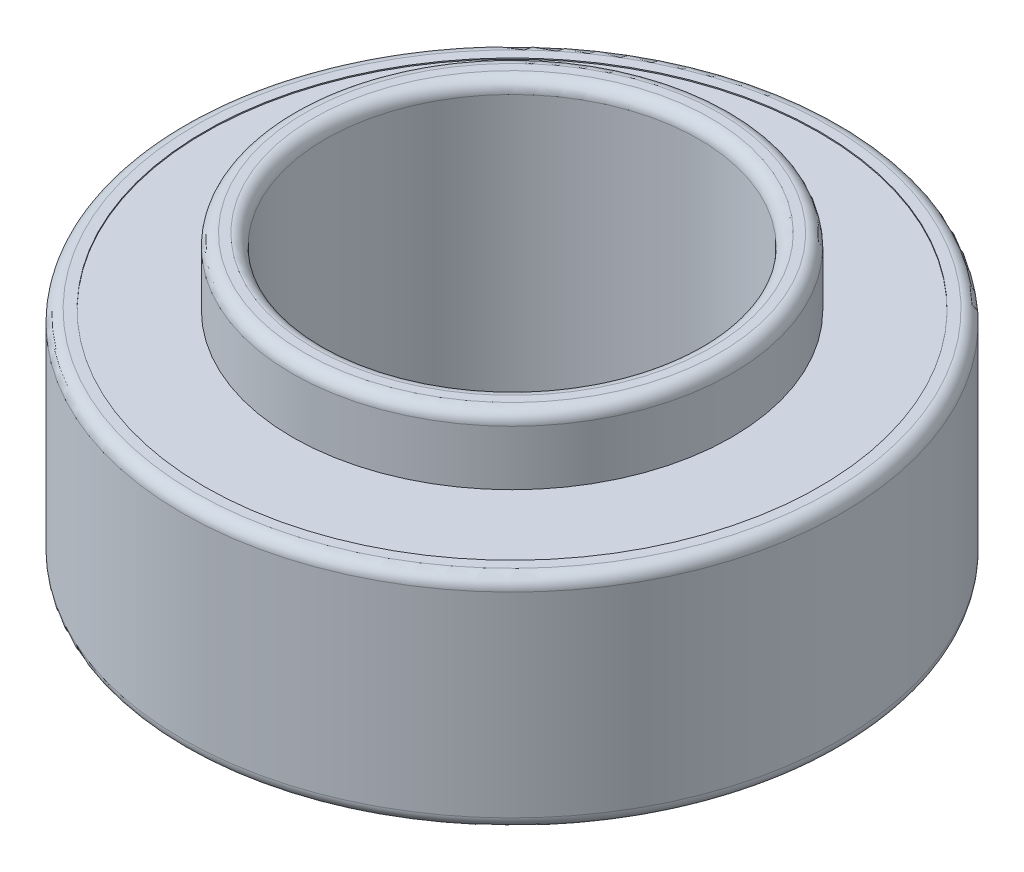
from build123d import *

# Parameters (mm, degrees)
SKETCH1_R           = 15
SKETCH1_R_2         = 8.5
BOSS_EXTRUDE1_DEPTH = 5
SKETCH2_R           = 10
SKETCH2_R_2         = 8.5
BOSS_EXTRUDE2_DEPTH = 3
CUT_EXTRUDE1_START  = -0.05
SKETCH3_R           = 14
SKETCH3_R_2         = 10
CUT_EXTRUDE1_DEPTH  = 0.05
FILLET1_R           = 0.55


with BuildPart() as part:
    # Sketch1 → Boss-Extrude1 (new, symmetric)
    with BuildSketch(Plane(origin=(0, 0, 0), x_dir=(1, 0, 0), z_dir=(0, 1, 0))):
        Circle(SKETCH1_R)
        Circle(SKETCH1_R_2, mode=Mode.SUBTRACT)
    extrude(amount=BOSS_EXTRUDE1_DEPTH, both=True)

    # Sketch2 → Boss-Extrude2 (add)
    with BuildSketch(Plane(origin=(0, 5, 0), x_dir=(1, 0, 0), z_dir=(0, 1, 0))):
        Circle(SKETCH2_R)
        Circle(SKETCH2_R_2, mode=Mode.SUBTRACT)
    extrude(amount=BOSS_EXTRUDE2_DEPTH)

    # Sketch3 → Cut-Extrude1 (cut)
    with BuildSketch(Plane(origin=(0, 5, 0), x_dir=(1, 0, 0), z_dir=(0, 1, 0)).offset(CUT_EXTRUDE1_START)):
        Circle(SKETCH3_R)
        Circle(SKETCH3_R_2, mode=Mode.SUBTRACT)
    cut_extrude1 = extrude(amount=CUT_EXTRUDE1_DEPTH, mode=Mode.SUBTRACT)

    # Mirror1: Cut-Extrude1 across plane
    add(cut_extrude1.mirror(Plane.ZX), mode=Mode.SUBTRACT)

    # Fillet1
    fillet1_edges = [part.edges().sort_by_distance(p)[0] for p in [
        (-8.5, 8, 0),
        (-8.5, -5, 0),
        (-15, -5, 0),
        (-15, 5, 0),
        (-10, 8, 0),
    ]]
    fillet(fillet1_edges, radius=FILLET1_R)


solid = part.part
